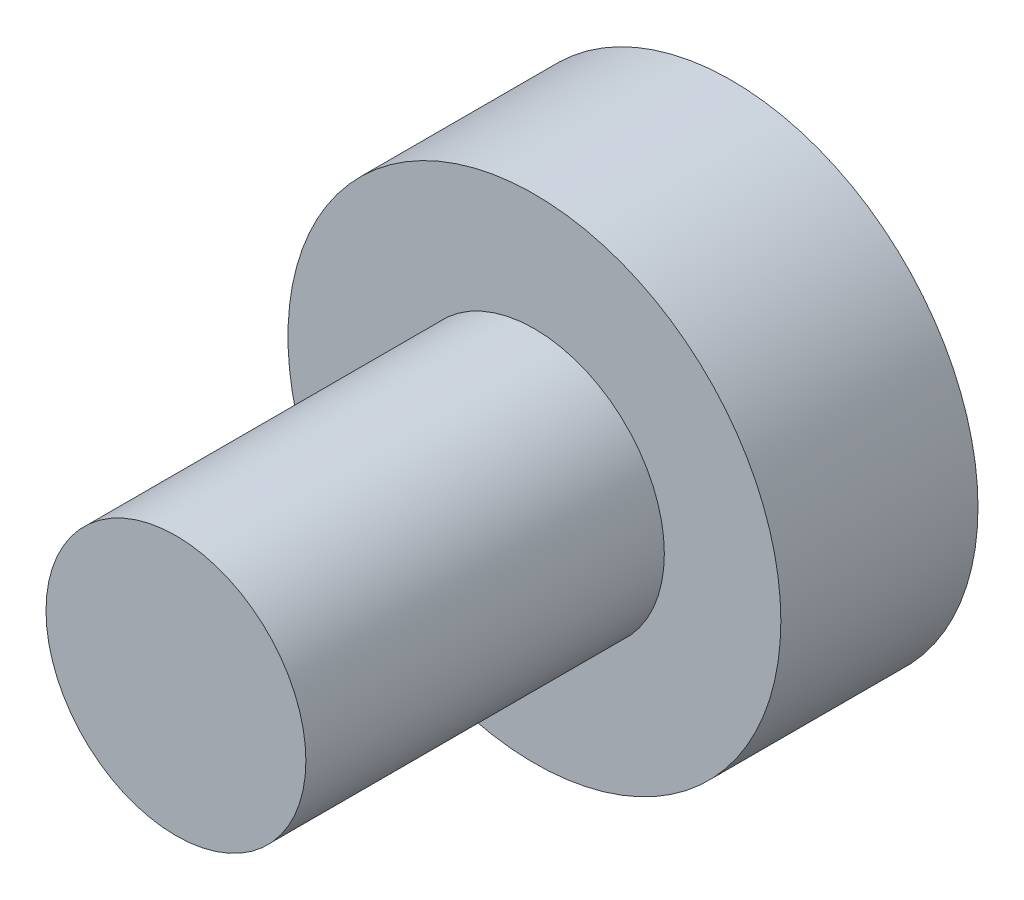
from build123d import *

# Parameters (mm, degrees)
BOSS_EXTRUDE1_START = -2.2
SKETCH1_R           = 2.75
BOSS_EXTRUDE1_DEPTH = 2.2
SKETCH2_R           = 1.45
BOSS_EXTRUDE2_DEPTH = 4


with BuildPart() as part:
    # Sketch1 → Boss-Extrude1 (new body)
    with BuildSketch(Plane.XY.offset(BOSS_EXTRUDE1_START)):
        Circle(SKETCH1_R)
    extrude(amount=BOSS_EXTRUDE1_DEPTH)

    # Sketch2 → Boss-Extrude2 (add)
    with BuildSketch(Plane.XY):
        Circle(SKETCH2_R)
    extrude(amount=BOSS_EXTRUDE2_DEPTH)


solid = part.part
